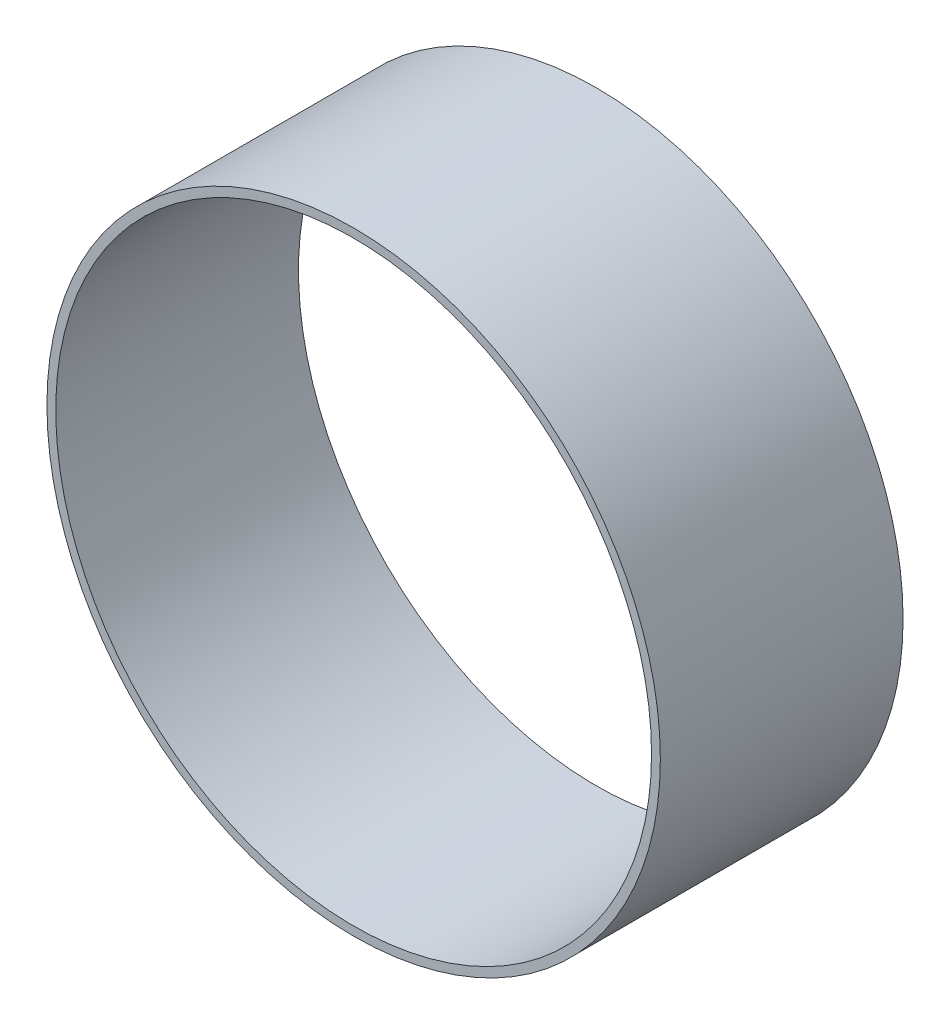
from build123d import *

# Parameters (mm, degrees)
PRINTED_FIXED_CASE_START = -27
SKETCH_1_R               = 69.5
SKETCH_1_R_2             = 67.5
PRINTED_FIXED_CASE_DEPTH = 55


with BuildPart() as part:
    # Эскиз1 → Printed_fixed_case (new body)
    with BuildSketch(Plane.XY.offset(PRINTED_FIXED_CASE_START)):
        Circle(SKETCH_1_R)
        Circle(SKETCH_1_R_2, mode=Mode.SUBTRACT)
    extrude(amount=PRINTED_FIXED_CASE_DEPTH)


solid = part.part
